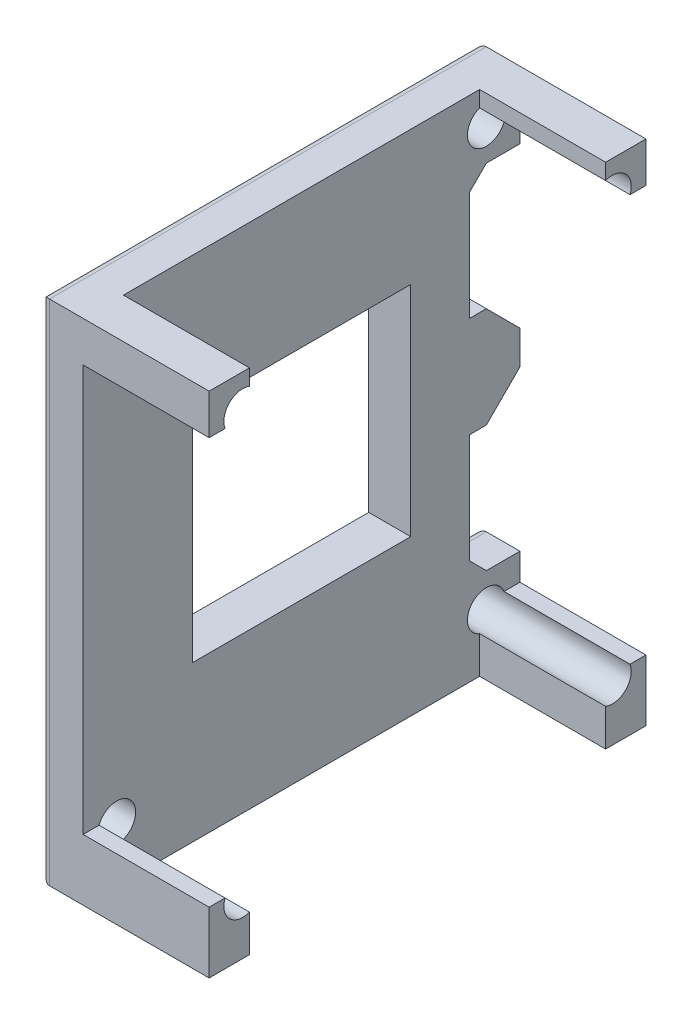
from build123d import *

# Parameters (mm, degrees)
SKETCH2_W               = 52
SKETCH2_H               = 58
SKETCH2_W_2             = 26
SKETCH2_H_2             = 26
BOSS_EXTRUDE1_DEPTH     = 5
SKETCH3_W               = 4.8
SKETCH3_H               = 4.8
BOSS_EXTRUDE2_DEPTH     = 15
M4_CLEARANCE_HOLE1_D    = 4.5
MIRROR2_COPY_1_SKETCH_W = 4.8
MIRROR2_COPY_1_SKETCH_H = 4.8
MIRROR2_COPY_1_DEPTH    = 15
MIRROR2_COPY_2_D        = 4.5
SKETCH7_W               = 6
SKETCH7_H               = 15
CUT_EXTRUDE1_DEPTH      = 44.783558558
CHAMFER1_SIZE           = 2
BOSS_EXTRUDE4_DEPTH     = 2.5
CHAMFER2_SIZE           = 4
FILLET1_R               = 1


with BuildPart() as part:
    # Sketch2 → Boss-Extrude1 (new body)
    with BuildSketch(Plane(origin=(0, 0, 0), x_dir=(0, 0, -1), z_dir=(1, 0, 0))):
        Rectangle(SKETCH2_W, SKETCH2_H)
        Rectangle(SKETCH2_W_2, SKETCH2_H_2, mode=Mode.SUBTRACT)
    extrude(amount=BOSS_EXTRUDE1_DEPTH)

    # Sketch3 → Boss-Extrude2 (add)
    with BuildSketch(Plane(origin=(5, 0, 0), x_dir=(0, 0, -1), z_dir=(1, 0, 0))):
        with Locations((-23.6, 26.6)):
            Rectangle(SKETCH3_W, SKETCH3_H)
    boss_extrude2 = extrude(amount=BOSS_EXTRUDE2_DEPTH)

    # M4 Clearance Hole1 (through all)
    with Locations(Plane(origin=(0, 25, 22), x_dir=(0, 0, -1), z_dir=(-1, 0, 0))):
        with Locations((0, 0)):
            m4_clearance_hole1 = Hole(M4_CLEARANCE_HOLE1_D / 2)

    # Mirror1: Boss-Extrude2, M4 Clearance Hole1 across plane
    add(boss_extrude2.mirror(Plane.XY))
    add(m4_clearance_hole1.mirror(Plane.XY), mode=Mode.SUBTRACT)

    # Mirror2: Boss-Extrude2, M4 Clearance Hole1 across plane
    add(boss_extrude2.mirror(Plane.ZX))
    add(m4_clearance_hole1.mirror(Plane.ZX), mode=Mode.SUBTRACT)

    # Mirror2 copy 1 sketch → Mirror2 copy 1 (add)
    with BuildSketch(Plane(origin=(5, 0, 0), x_dir=(0, 0, 1), z_dir=(1, 0, 0))):
        with Locations((-23.6, 26.6)):
            Rectangle(MIRROR2_COPY_1_SKETCH_W, MIRROR2_COPY_1_SKETCH_H)
    extrude(amount=MIRROR2_COPY_1_DEPTH)

    # Mirror2 copy 2 (through all)
    with Locations(Plane(origin=(0, -25, -22), x_dir=(0, 0, 1), z_dir=(-1, 0, 0))):
        with Locations((0, 0)):
            Hole(MIRROR2_COPY_2_D / 2)

    # Sketch7 → Cut-Extrude1 (cut, through all)
    with BuildSketch(Plane.ZY):
        with Locations((-23, 13.5)):
            Rectangle(SKETCH7_W, SKETCH7_H)
    cut_extrude1 = extrude(amount=-CUT_EXTRUDE1_DEPTH, mode=Mode.SUBTRACT)

    # Mirror3: Cut-Extrude1 across plane
    add(cut_extrude1.mirror(Plane.ZX), mode=Mode.SUBTRACT)

    # Chamfer1
    chamfer1_edges = [part.edges().sort_by_distance(p)[0] for p in [
        (2.5, 21, -20),
        (2.5, -21, -20),
    ]]
    chamfer(chamfer1_edges, length=CHAMFER1_SIZE)

    # Sketch9 → Boss-Extrude4 (add)
    with BuildSketch(Plane.XZ.offset(29)):
        Polygon((0, 26), (0, -26), (20, -26), (20, -21.2), (5, -21.2), (5, 21.2), (20, 21.2), (20, 26), align=None)
    extrude(amount=BOSS_EXTRUDE4_DEPTH)

    # Chamfer2
    chamfer2_edges = [part.edges().sort_by_distance(p)[0] for p in [
        (2.5, 6, -26),
        (2.5, -6, -26),
    ]]
    chamfer(chamfer2_edges, length=CHAMFER2_SIZE)

    # Fillet1
    fillet1_edges = [part.edges().sort_by_distance(p)[0] for p in [
        (0, 25, -26),
        (0, 12.5, -20),
        (0, -12.5, -20),
        (0, -21, -24),
        (0, 21, -24),
        (0, -20, -21),
        (0, 20, -21),
        (0, -31.5, 0),
        (0, 0, -26),
        (0, 6, -21),
        (0, -6, -21),
        (0, -4, -24),
        (0, 4, -24),
        (0, 29, 0),
        (0, -26.25, -26),
        (0, -1.25, 26),
    ]]
    fillet(fillet1_edges, radius=FILLET1_R)


solid = part.part
